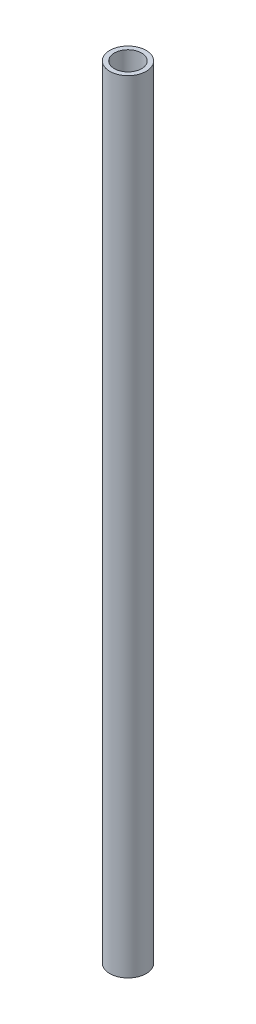
from build123d import *

# Parameters (mm, degrees)
SKETCH1_R           = 12.7
SKETCH1_R_2         = 9.525
BOSS_EXTRUDE2_DEPTH = 546.1


with BuildPart() as part:
    # Sketch1 → Boss-Extrude2 (new body)
    with BuildSketch(Plane(origin=(0, 0, 0), x_dir=(1, 0, 0), z_dir=(0, 1, 0))):
        with Locations(Location((-391.181668083, 212.743279788, 0), (0, 0, 270))):
            Circle(SKETCH1_R)
        with Locations(Location((-391.181668083, 212.743279788, 0), (0, 0, 270))):
            Circle(SKETCH1_R_2, mode=Mode.SUBTRACT)
    extrude(amount=BOSS_EXTRUDE2_DEPTH)


solid = part.part
